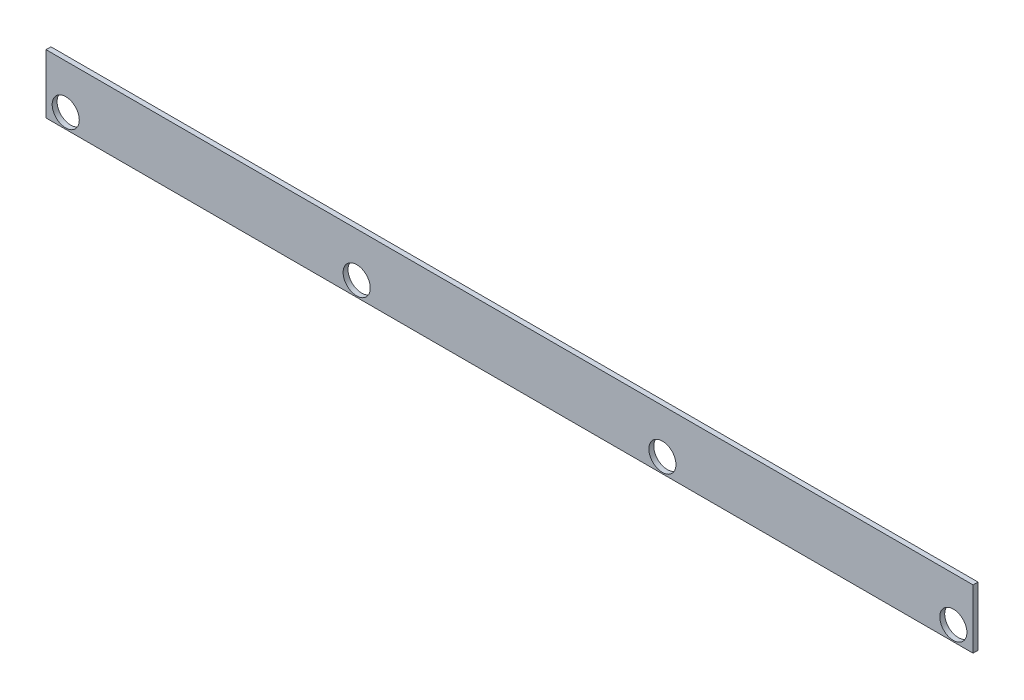
from build123d import *

# Parameters (mm, degrees)
M5_FLOOR_ATTACHMENTS_PROFILE_W = 188
M5_FLOOR_ATTACHMENTS_PROFILE_H = 12
M5_FLOOR_ATTACHMENTS_PROFILE_R = 2.75
M5_FLOOR_ATTACHMENTS_DEPTH     = 1


with BuildPart() as part:
    # M5 floor attachments profile → M5 floor attachments (new body)
    with BuildSketch(Plane.XY):
        with Locations((0, -6)):
            Rectangle(M5_FLOOR_ATTACHMENTS_PROFILE_W, M5_FLOOR_ATTACHMENTS_PROFILE_H)
        with Locations((-90, -9)):
            Circle(M5_FLOOR_ATTACHMENTS_PROFILE_R, mode=Mode.SUBTRACT)
        with Locations((-31, -9)):
            Circle(M5_FLOOR_ATTACHMENTS_PROFILE_R, mode=Mode.SUBTRACT)
        with Locations((31, -9)):
            Circle(M5_FLOOR_ATTACHMENTS_PROFILE_R, mode=Mode.SUBTRACT)
        with Locations((90, -9)):
            Circle(M5_FLOOR_ATTACHMENTS_PROFILE_R, mode=Mode.SUBTRACT)
    extrude(amount=M5_FLOOR_ATTACHMENTS_DEPTH)


solid = part.part
